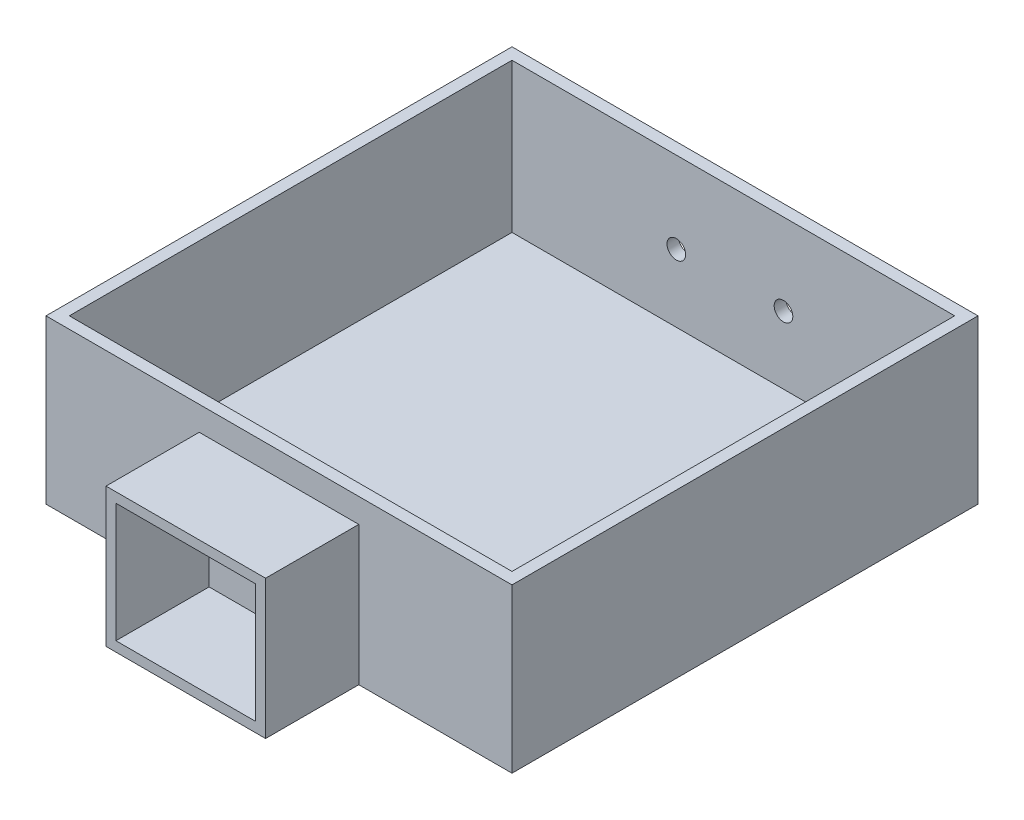
from build123d import *

# Parameters (mm, degrees)
SKETCH_1_W               = 100
SKETCH_1_H               = 100
EXTRUDE_1_DEPTH          = 35
SKETCH_2_W               = 95
SKETCH_2_H               = 95
CUT_EXTRUDE_1_DEPTH      = 32
CUT_EXTRUDE_2_DEPTH      = 118.153745139
CUT_EXTRUDE_2_DEPTH_BACK = 32
SKETCH_3_R               = 10
SKETCH_4_R               = 2
CUT_EXTRUDE_3_DEPTH      = 32
EXTRUDE_2_DEPTH          = 20
SKETCH_6_W               = 29.993378998
SKETCH_6_H               = 25.557725667
CUT_EXTRUDE_4_DEPTH      = 118.153745139


with BuildPart() as part:
    # Эскиз1 → Бобышка-Вытянуть1 (new body)
    with BuildSketch(Plane(origin=(0, 0, 0), x_dir=(1, 0, 0), z_dir=(0, 1, 0))):
        Rectangle(SKETCH_1_W, SKETCH_1_H)
    extrude(amount=EXTRUDE_1_DEPTH)

    # Эскиз2 → Вырез-Вытянуть1 (cut)
    with BuildSketch(Plane(origin=(0, 35, 0), x_dir=(1, 0, 0), z_dir=(0, 1, 0))):
        Rectangle(SKETCH_2_W, SKETCH_2_H)
    extrude(amount=-CUT_EXTRUDE_1_DEPTH, mode=Mode.SUBTRACT)

    # Эскиз3 → Вырез-Вытянуть2 (cut, two sides: drawn at the far end of the back side and taken through both)
    with BuildSketch(Plane.XY.offset(50).offset(-CUT_EXTRUDE_2_DEPTH_BACK)):
        with Locations(Location((0, 17.5, 0), (0, 0, 180))):
            Circle(SKETCH_3_R)
    extrude(amount=CUT_EXTRUDE_2_DEPTH + CUT_EXTRUDE_2_DEPTH_BACK, mode=Mode.SUBTRACT)

    # Эскиз4 → Вырез-Вытянуть3 (cut)
    with BuildSketch(Plane(origin=(0, 0, -50), x_dir=(-1, 0, 0), z_dir=(0, 0, -1))):
        with Locations((-10.76282056, 17.5)):
            Circle(SKETCH_4_R)
        with Locations((12.23717944, 17.5)):
            Circle(SKETCH_4_R)
    extrude(amount=-CUT_EXTRUDE_3_DEPTH, mode=Mode.SUBTRACT)

    # Эскиз5 → Бобышка-Вытянуть2 (add)
    with BuildSketch(Plane.XY.offset(50)):
        Polygon((-17.118009843, 5.199633646), (-17.118009843, 0), (17.118009843, 0), (17.118009843, 5.199633646), (17.118009843, 29.800366354), (-17.118009843, 29.800366354), align=None)
    extrude(amount=EXTRUDE_2_DEPTH)

    # Эскиз6 → Вырез-Вытянуть4 (cut, through all)
    with BuildSketch(Plane(origin=(0, 0, 50), x_dir=(-1, 0, 0), z_dir=(0, 0, -1))):
        with Locations((0, 14.900183178)):
            Rectangle(SKETCH_6_W, SKETCH_6_H)
    extrude(amount=-CUT_EXTRUDE_4_DEPTH, mode=Mode.SUBTRACT)


solid = part.part
